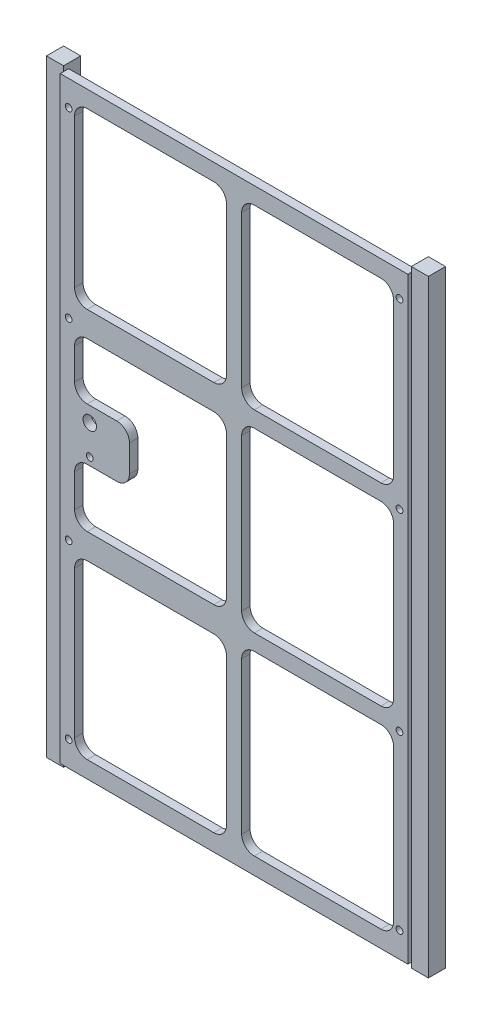
from build123d import *

# Parameters (mm, degrees)
P_IDAT_VYSUNUT_M1_DEPTH        = 5
SKICA5_W                       = 10.15
SKICA5_H                       = 360
P_IDAT_VYSUNUT_M5_DEPTH        = 7.15
ODEBRAT_VYSUNUT_M1_DEPTH       = 213.956673997
ODEBRAT_VYSUNUT_M1_DEPTH_BACK  = 213.956673997
SKICA9_R                       = 2
ODEBRAT_VYSUNUT_M3_DEPTH       = 213.956673997
SKICA13_R                      = 3.5
ODEBRAT_VYSUNUT_M9_DEPTH       = 9.15
P_IDAT_VYSUNUT_M6_DEPTH        = 5
SKICA15_R                      = 4
P_IDAT_VYSUNUT_M7_DEPTH        = 5
SKICA16_R                      = 2
ODEBRAT_VYSUNUT_M10_DEPTH      = 213.729981432
SKICA17_R                      = 3.5
ODEBRAT_VYSUNUT_M11_DEPTH      = 2
LINPOLE1_COUNT                 = 2
LINPOLE1_PITCH                 = 114
ODEBRAT_VYSUNUT_M12_DEPTH      = 378.430847971
ODEBRAT_VYSUNUT_M12_DEPTH_BACK = 378.430847971
SKICA18_W                      = 10.15
SKICA18_H                      = 2


with BuildPart() as part:
    # Skica1 → Přidat vysunutím1 (new body)
    with BuildSketch(Plane.XY):
        Polygon((113.15, -180), (113.15, 180), (103, 180), (103, 177), (-103, 177), (-103, 180), (-113.15, 180), (-113.15, -180), (-103, -180), (-103, -177), (103, -177), (103, -180), align=None)
    extrude(amount=P_IDAT_VYSUNUT_M1_DEPTH)

    # Skica5 → Přidat vysunutím5 (add)
    with BuildSketch(Plane(origin=(0, 0, 0), x_dir=(-1, 0, 0), z_dir=(0, 0, -1))):
        with Locations((108.075, 0)):
            Rectangle(SKICA5_W, SKICA5_H)
        with Locations((-108.075, 0)):
            Rectangle(SKICA5_W, SKICA5_H)
    extrude(amount=P_IDAT_VYSUNUT_M5_DEPTH)

    # Skica7 → Odebrat vysunutím1 (cut, two sides: drawn at the far end of the back side and taken through both)
    with BuildSketch(Plane.XY.offset(5).offset(-ODEBRAT_VYSUNUT_M1_DEPTH_BACK)):
        with BuildLine():
            Line((12, 167), (87, 167))
            ThreePointArc((87, 167), (92.303300859, 164.803300859), (94.5, 159.5))
            Line((94.5, 159.5), (94.5, 69.5))
            ThreePointArc((94.5, 69.5), (92.303300859, 64.196699141), (87, 62))
            Line((87, 62), (12, 62))
            ThreePointArc((12, 62), (6.696699141, 64.196699141), (4.5, 69.5))
            Line((4.5, 69.5), (4.5, 159.5))
            ThreePointArc((4.5, 159.5), (6.696699141, 164.803300859), (12, 167))
        make_face()
        with BuildLine():
            Line((-12, 167), (-87, 167))
            ThreePointArc((-87, 167), (-92.303300859, 164.803300859), (-94.5, 159.5))
            Line((-94.5, 159.5), (-94.5, 69.5))
            ThreePointArc((-94.5, 69.5), (-92.303300859, 64.196699141), (-87, 62))
            Line((-87, 62), (-12, 62))
            ThreePointArc((-12, 62), (-6.696699141, 64.196699141), (-4.5, 69.5))
            Line((-4.5, 69.5), (-4.5, 159.5))
            ThreePointArc((-4.5, 159.5), (-6.696699141, 164.803300859), (-12, 167))
        make_face()
        with BuildLine():
            Line((94.5, 45), (94.5, -45))
            ThreePointArc((94.5, -45), (92.303300859, -50.303300859), (87, -52.5))
            Line((87, -52.5), (12, -52.5))
            ThreePointArc((12, -52.5), (6.696699141, -50.303300859), (4.5, -45))
            Line((4.5, -45), (4.5, 45))
            ThreePointArc((4.5, 45), (6.696699141, 50.303300859), (12, 52.5))
            Line((12, 52.5), (87, 52.5))
            ThreePointArc((87, 52.5), (92.303300859, 50.303300859), (94.5, 45))
        make_face()
        with BuildLine():
            Line((-94.5, 45), (-94.5, -45))
            ThreePointArc((-94.5, -45), (-92.303300859, -50.303300859), (-87, -52.5))
            Line((-87, -52.5), (-12, -52.5))
            ThreePointArc((-12, -52.5), (-6.696699141, -50.303300859), (-4.5, -45))
            Line((-4.5, -45), (-4.5, 45))
            ThreePointArc((-4.5, 45), (-6.696699141, 50.303300859), (-12, 52.5))
            Line((-12, 52.5), (-87, 52.5))
            ThreePointArc((-87, 52.5), (-92.303300859, 50.303300859), (-94.5, 45))
        make_face()
        with BuildLine():
            Line((94.5, -69.5), (94.5, -159.5))
            ThreePointArc((94.5, -159.5), (92.303300859, -164.803300859), (87, -167))
            Line((87, -167), (12, -167))
            ThreePointArc((12, -167), (6.696699141, -164.803300859), (4.5, -159.5))
            Line((4.5, -159.5), (4.5, -69.5))
            ThreePointArc((4.5, -69.5), (6.696699141, -64.196699141), (12, -62))
            Line((12, -62), (87, -62))
            ThreePointArc((87, -62), (92.303300859, -64.196699141), (94.5, -69.5))
        make_face()
        with BuildLine():
            Line((-94.5, -69.5), (-94.5, -159.5))
            ThreePointArc((-94.5, -159.5), (-92.303300859, -164.803300859), (-87, -167))
            Line((-87, -167), (-12, -167))
            ThreePointArc((-12, -167), (-6.696699141, -164.803300859), (-4.5, -159.5))
            Line((-4.5, -159.5), (-4.5, -69.5))
            ThreePointArc((-4.5, -69.5), (-6.696699141, -64.196699141), (-12, -62))
            Line((-12, -62), (-87, -62))
            ThreePointArc((-87, -62), (-92.303300859, -64.196699141), (-94.5, -69.5))
        make_face()
    extrude(amount=ODEBRAT_VYSUNUT_M1_DEPTH + ODEBRAT_VYSUNUT_M1_DEPTH_BACK, mode=Mode.SUBTRACT)

    # Skica9 → Odebrat vysunutím3 (cut, through all)
    with BuildSketch(Plane(origin=(0, 0, -7.15), x_dir=(-1, 0, 0), z_dir=(0, 0, -1))):
        with Locations((98, 162)):
            Circle(SKICA9_R)
        with Locations((98, 54)):
            Circle(SKICA9_R)
        with Locations((98, -162)):
            Circle(SKICA9_R)
        with Locations((98, -60)):
            Circle(SKICA9_R)
    odebrat_vysunut_m3 = extrude(amount=-ODEBRAT_VYSUNUT_M3_DEPTH, mode=Mode.SUBTRACT)

    # Zrcadlit2: Odebrat vysunutím3 across plane
    add(odebrat_vysunut_m3.mirror(Plane(origin=(0, 0, 0), x_dir=(0, 0, 1), z_dir=(1, 0, 0))), mode=Mode.SUBTRACT)

    # Skica13 → Odebrat vysunutím9 (cut)
    with BuildSketch(Plane(origin=(0, 0, -7.15), x_dir=(-1, 0, 0), z_dir=(0, 0, -1))):
        with Locations((98, 162)):
            Circle(SKICA13_R)
        with Locations((98, 54)):
            Circle(SKICA13_R)
        with Locations((98, -162)):
            Circle(SKICA13_R)
        with Locations((98, -60)):
            Circle(SKICA13_R)
    odebrat_vysunut_m9 = extrude(amount=-ODEBRAT_VYSUNUT_M9_DEPTH, mode=Mode.SUBTRACT)

    # Zrcadlit3: Odebrat vysunutím9 across plane
    add(odebrat_vysunut_m9.mirror(Plane(origin=(0, 0, 0), x_dir=(0, 0, 1), z_dir=(1, 0, 0))), mode=Mode.SUBTRACT)

    # Skica14 → Přidat vysunutím6 (add)
    with BuildSketch(Plane(origin=(0, 0, 0), x_dir=(-1, 0, 0), z_dir=(0, 0, -1))):
        with BuildLine():
            Line((94.5, 71.5), (94.5, 41.5))
            ThreePointArc((94.5, 41.5), (92.303300859, 46.803300859), (87, 49))
            Line((87, 49), (12, 49))
            ThreePointArc((12, 49), (6.696699141, 46.803300859), (4.5, 41.5))
            Line((4.5, 41.5), (4.5, 71.5))
            ThreePointArc((4.5, 71.5), (6.696699141, 66.196699141), (12, 64))
            Line((12, 64), (87, 64))
            ThreePointArc((87, 64), (92.303300859, 66.196699141), (94.5, 71.5))
        make_face()
    p_idat_vysunut_m6 = extrude(amount=-P_IDAT_VYSUNUT_M6_DEPTH)

    # Skica15 → Přidat vysunutím7 (add)
    with BuildSketch(Plane(origin=(0, 0, 0), x_dir=(-1, 0, 0), z_dir=(0, 0, -1))):
        with BuildLine():
            Line((87, 15.5), (69.5, 15.5))
            ThreePointArc((69.5, 15.5), (64.196699141, 13.303300859), (62, 8))
            Line((62, 8), (62, -8))
            ThreePointArc((62, -8), (64.196699141, -13.303300859), (69.5, -15.5))
            Line((69.5, -15.5), (87, -15.5))
            ThreePointArc((87, -15.5), (92.303300859, -17.696699141), (94.5, -23))
            Line((94.5, -23), (94.5, 23))
            ThreePointArc((94.5, 23), (92.303300859, 17.696699141), (87, 15.5))
        make_face()
        with Locations((85.5, 6.5)):
            Circle(SKICA15_R, mode=Mode.SUBTRACT)
    extrude(amount=-P_IDAT_VYSUNUT_M7_DEPTH)

    # Skica16 → Odebrat vysunutím10 (cut, through all)
    with BuildSketch(Plane(origin=(0, 0, 0), x_dir=(-1, 0, 0), z_dir=(0, 0, -1))):
        with Locations((85.5, -11)):
            Circle(SKICA16_R)
    extrude(amount=-ODEBRAT_VYSUNUT_M10_DEPTH, mode=Mode.SUBTRACT)

    # Skica17 → Odebrat vysunutím11 (cut)
    with BuildSketch(Plane(origin=(0, 0, 0), x_dir=(-1, 0, 0), z_dir=(0, 0, -1))):
        with Locations((85.5, -11)):
            Circle(SKICA17_R)
    extrude(amount=-ODEBRAT_VYSUNUT_M11_DEPTH, mode=Mode.SUBTRACT)

    # LinPole1: Přidat vysunutím6 ×2
    with Locations(*[(0, -i * LINPOLE1_PITCH, 0) for i in range(1, LINPOLE1_COUNT)]):
        add(p_idat_vysunut_m6)

    # Skica18 → Odebrat vysunutím12 (cut, two sides: drawn at the far end of the back side and taken through both)
    with BuildSketch(Plane(origin=(0, 180, 0), x_dir=(1, 0, 0), z_dir=(0, 1, 0)).offset(-ODEBRAT_VYSUNUT_M12_DEPTH_BACK)):
        with Locations((-108.075, -4)):
            Rectangle(SKICA18_W, SKICA18_H)
        with Locations((108.075, -4)):
            Rectangle(SKICA18_W, SKICA18_H)
    extrude(amount=ODEBRAT_VYSUNUT_M12_DEPTH + ODEBRAT_VYSUNUT_M12_DEPTH_BACK, mode=Mode.SUBTRACT)


solid = part.part
